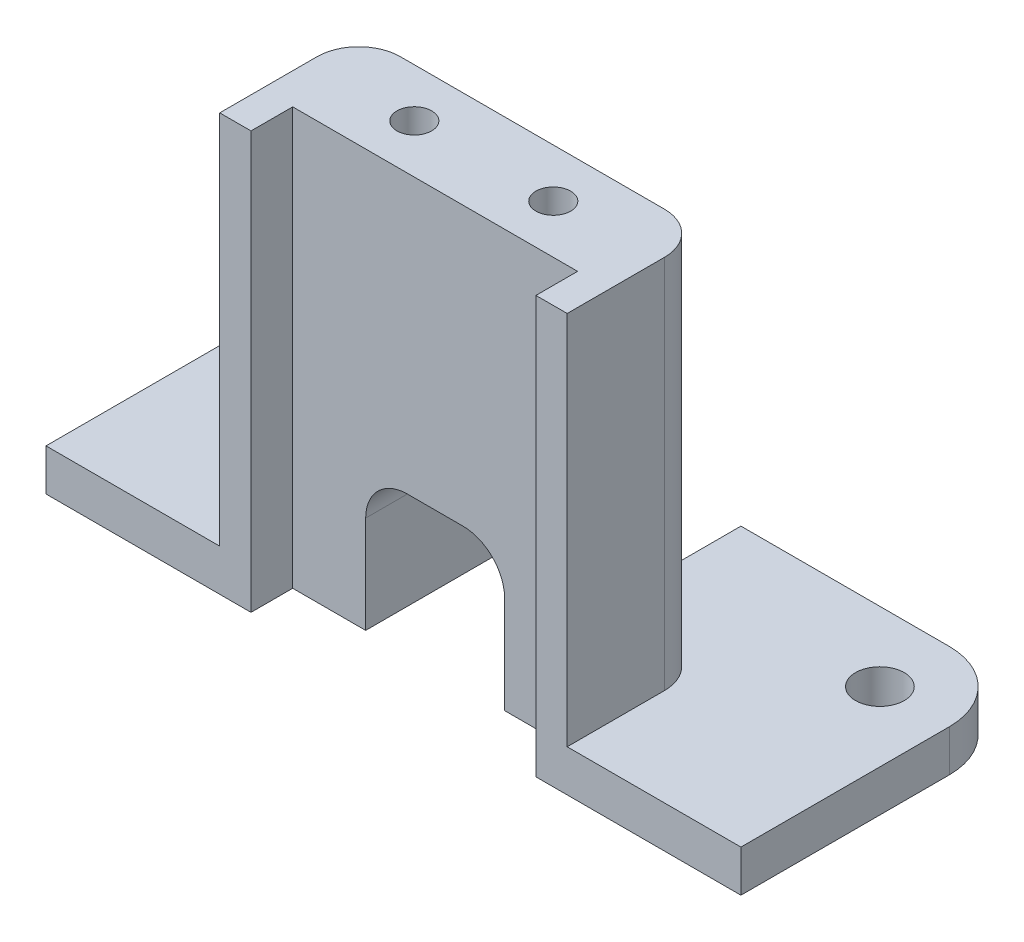
from build123d import *

# Parameters (mm, degrees)
SKETCH_1_W          = 25
SKETCH_1_H          = 30
EXTRUDE_1_DEPTH     = 10
SKETCH_2_W          = 20.5
SKETCH_2_H          = 30
CUT_EXTRUDE_1_DEPTH = 3
SKETCH_3_R          = 1.25
CUT_EXTRUDE_2_DEPTH = 12
SKETCH_5_W          = 10
SKETCH_5_H          = 10
CUT_EXTRUDE_4_DEPTH = 12
FILLET_1_R          = 3
EXTRUDE_2_DEPTH     = 3
FILLET_2_R          = 5
SKETCH_7_R          = 1.75
CUT_EXTRUDE_5_DEPTH = 3


with BuildPart() as part:
    # 스케치1 → 보스-돌출1 (new body)
    with BuildSketch(Plane.XY):
        with Locations((12.5, 15)):
            Rectangle(SKETCH_1_W, SKETCH_1_H)
    extrude(amount=EXTRUDE_1_DEPTH)

    # 스케치2 → 컷-돌출1 (cut)
    with BuildSketch(Plane.XY.offset(10)):
        with Locations((12.5, 15)):
            Rectangle(SKETCH_2_W, SKETCH_2_H)
    extrude(amount=-CUT_EXTRUDE_1_DEPTH, mode=Mode.SUBTRACT)

    # 스케치3 → 컷-돌출2 (cut)
    with BuildSketch(Plane(origin=(0, 30, 0), x_dir=(1, 0, 0), z_dir=(0, 1, 0))):
        with Locations(Location((7.5, -3.5, 0), (0, 0, 270))):
            Circle(SKETCH_3_R)
        with Locations(Location((17.5, -3.5, 0), (0, 0, 270))):
            Circle(SKETCH_3_R)
    extrude(amount=-CUT_EXTRUDE_2_DEPTH, mode=Mode.SUBTRACT)

    # 스케치5 → 컷-돌출4 (cut)
    with BuildSketch(Plane(origin=(0, 0, 0), x_dir=(-1, 0, 0), z_dir=(0, 0, -1))):
        with Locations((-12.5, 5)):
            Rectangle(SKETCH_5_W, SKETCH_5_H)
    extrude(amount=-CUT_EXTRUDE_4_DEPTH, mode=Mode.SUBTRACT)

    # 필렛1
    fillet_1_edges = [part.edges().sort_by_distance(p)[0] for p in [
        (17.5, 10, 3.5),
        (7.5, 10, 3.5),
        (25, 15, 0),
        (0, 15, 0),
    ]]
    fillet(fillet_1_edges, radius=FILLET_1_R)

    # 스케치6 → 보스-돌출2 (add)
    with BuildSketch(Plane.XZ):
        Polygon((22.75, 10), (37.5, 10), (37.5, -10), (17.5, -10), (17.5, 7), (22.75, 7), align=None)
        with BuildLine():
            Line((7.5, -10), (7.5, 0))
            Line((7.5, 0), (3, 0))
            ThreePointArc((3, 0), (0.878679656, 0.878679656), (0, 3))
            Line((0, 3), (0, 10))
            Line((0, 10), (-12.5, 10))
            Line((-12.5, 10), (-12.5, -10))
            Line((-12.5, -10), (-3.976787784, -10))
            Line((-3.976787784, -10), (7.5, -10))
        make_face()
    extrude(amount=-EXTRUDE_2_DEPTH)

    # 필렛2
    fillet_2_edges = [part.edges().sort_by_distance(p)[0] for p in [
        (-12.5, 1.5, -10),
        (37.5, 1.5, -10),
    ]]
    fillet(fillet_2_edges, radius=FILLET_2_R)

    # 스케치7 → 컷-돌출5 (cut)
    with BuildSketch(Plane(origin=(0, 3, 0), x_dir=(1, 0, 0), z_dir=(0, 1, 0))):
        with Locations(Location((32.5, 5, 0), (0, 0, 270))):
            Circle(SKETCH_7_R)
        with Locations(Location((-7.5, 5, 0), (0, 0, 270))):
            Circle(SKETCH_7_R)
    extrude(amount=-CUT_EXTRUDE_5_DEPTH, mode=Mode.SUBTRACT)


solid = part.part
